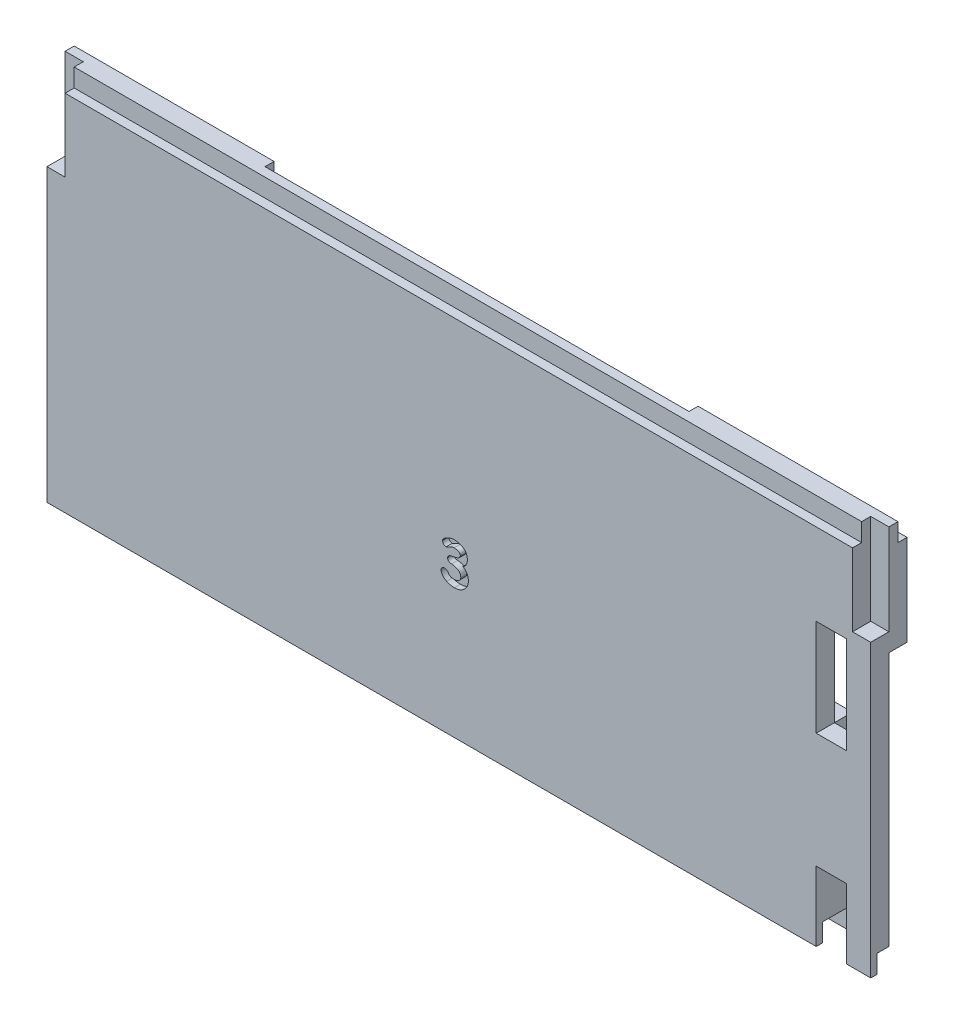
from build123d import *

# Parameters (mm, degrees)
SKETCH_1_W           = 130
SKETCH_1_H           = 60
EXTRUDE_1_DEPTH      = 6
EXTRUDE_2_DEPTH      = 3
EXTRUDE_2_DEPTH_BACK = 133
SKETCH_3_W           = 138.559648247
SKETCH_3_H           = 4
CUT_EXTRUDE_1_DEPTH  = 3
SKETCH_4_W           = 130
SKETCH_4_H           = 1.5
EXTRUDE_3_DEPTH      = 3
SKETCH_5_W           = 5
SKETCH_5_H           = 11.5
SKETCH_5_H_2         = 16
CUT_EXTRUDE_3_DEPTH  = 84.232914739
SKETCH_6_W           = 24
SKETCH_6_H           = 16
SKETCH_6_W_2         = 70
SKETCH_6_H_2         = 22.052103864
CUT_EXTRUDE_4_DEPTH  = 3
SKETCH_7_W           = 5
SKETCH_7_H           = 19
CUT_EXTRUDE_5_DEPTH  = 3
CUT_EXTRUDE_6_DEPTH  = 1


with BuildPart() as part:
    # 草圖1 → 填料-伸長1 (new body)
    with BuildSketch(Plane.XY):
        with Locations((7.338709677, 1.86827957)):
            Rectangle(SKETCH_1_W, SKETCH_1_H)
    extrude(amount=EXTRUDE_1_DEPTH)

    # 草圖2 → 填料-伸長2 (add, two sides: drawn at the far end of the back side and taken through both)
    with BuildSketch(Plane.ZY.offset(57.661290323).offset(-EXTRUDE_2_DEPTH_BACK)):
        Polygon((3, 16.86827957), (3, -28.13172043), (6, -28.13172043), (6, 19.86827957), (3, 19.86827957), align=None)
        Polygon((0, 16.86827957), (3, 16.86827957), (3, 19.86827957), (3, 31.86827957), (0, 31.86827957), align=None)
    extrude(amount=EXTRUDE_2_DEPTH + EXTRUDE_2_DEPTH_BACK)

    # 草圖3 → 除料-伸長1 (cut)
    with BuildSketch(Plane.XZ.offset(28.13172043)):
        with Locations((8.618533801, 3)):
            Rectangle(SKETCH_3_W, SKETCH_3_H)
    extrude(amount=-CUT_EXTRUDE_1_DEPTH, mode=Mode.SUBTRACT)

    # 草圖4 → 填料-伸長3 (add)
    with BuildSketch(Plane(origin=(0, 31.86827957, 0), x_dir=(1, 0, 0), z_dir=(0, 1, 0))):
        Polygon((-60.661290323, -3), (-57.661290323, -3), (72.338709677, -3), (75.338709677, -3), (75.338709677, -1.5), (-60.661290323, -1.5), align=None)
        with Locations((7.338709677, -3.75)):
            Rectangle(SKETCH_4_W, SKETCH_4_H)
    extrude(amount=EXTRUDE_3_DEPTH)

    # 草圖5 → 除料-伸長3 (cut, through all)
    with BuildSketch(Plane.XY.offset(6)):
        with Locations((68.838709677, -22.38172043)):
            Rectangle(SKETCH_5_W, SKETCH_5_H)
        with Locations((68.838709677, 10.36827957)):
            Rectangle(SKETCH_5_W, SKETCH_5_H_2)
    extrude(amount=-CUT_EXTRUDE_3_DEPTH, mode=Mode.SUBTRACT)

    # 草圖6 → 除料-伸長4 (cut)
    with BuildSketch(Plane(origin=(0, 0, 0), x_dir=(-1, 0, 0), z_dir=(0, 0, -1))):
        with Locations((-54.338709677, 10.36827957)):
            Rectangle(SKETCH_6_W, SKETCH_6_H)
        Polygon((27.661290323, 31.86827957), (-42.338709677, 31.86827957), (-42.338709677, 18.36827957), (-42.338709677, 2.36827957), (-42.338709677, -28.13172043), (27.661290323, -28.13172043), align=None)
        with Locations((-7.338709677, 42.894331502)):
            Rectangle(SKETCH_6_W_2, SKETCH_6_H_2)
    extrude(amount=-CUT_EXTRUDE_4_DEPTH, mode=Mode.SUBTRACT)

    # 草圖7 → 除料-伸長5 (cut)
    with BuildSketch(Plane(origin=(0, 0, 0), x_dir=(-1, 0, 0), z_dir=(0, 0, -1))):
        with Locations((-68.838709677, -7.13172043)):
            Rectangle(SKETCH_7_W, SKETCH_7_H)
    extrude(amount=-CUT_EXTRUDE_5_DEPTH, mode=Mode.SUBTRACT)

    # 草圖8 → 除料-伸長6 (cut)
    with BuildSketch(Plane.XY.offset(6)):
        with BuildLine():
            add(Edge.make_bspline(
                [(7.993418423, -2.970530339), (8.066595255, -3.013406491), (8.209521604, -3.097150642), (8.397381765, -3.253578026), (8.557581678, -3.427102139), (8.688705265, -3.620209151), (8.7897691, -3.832667722), (8.861606325, -4.063976346), (8.905399678, -4.313892399), (8.910437631, -4.486921314), (8.913029245, -4.575930481)],
                knots=[0, 0, 0, 0, 1.041256662, 2.033744932, 2.992333589, 3.936645621, 4.892015142, 5.874009964, 6.906352718, 8, 8, 8, 8], degree=3))
            add(Edge.make_bspline(
                [(8.913029245, -4.575930481), (8.911078345, -4.648761548), (8.907228033, -4.792501525), (8.87497864, -5.003549485), (8.822960176, -5.205981757), (8.748960612, -5.399447188), (8.654518955, -5.585062154), (8.537449928, -5.761295514), (8.400436171, -5.929609222), (8.244900224, -6.087682907), (8.074008598, -6.231142903), (7.892336287, -6.357850537), (7.701900039, -6.465313543), (7.501107997, -6.551899348), (7.292132833, -6.620109721), (7.073742385, -6.667786693), (6.847015683, -6.699539269), (6.692488686, -6.702389234), (6.61400219, -6.703836772)],
                knots=[0, 0, 0, 0, 1.002212465, 1.977974553, 2.931743396, 3.874694811, 4.82372372, 5.793001409, 6.781622883, 7.807418376, 8.841256573, 9.848957519, 10.852728399, 11.846063664, 12.854548786, 13.874037145, 14.920192732, 16, 16, 16, 16], degree=3))
            add(Edge.make_bspline(
                [(6.61400219, -6.703836772), (6.555183939, -6.703340941), (6.438669406, -6.702358738), (6.266544424, -6.686756349), (6.098546063, -6.665219681), (5.935016705, -6.633611185), (5.775632036, -6.59357328), (5.621264601, -6.542963144), (5.4701808, -6.486918755), (5.374004403, -6.439909879), (5.326024534, -6.41645839)],
                knots=[0, 0, 0, 0, 1.05965718, 2.099101179, 3.112385412, 4.111224021, 5.099027455, 6.071848788, 7.038096178, 8, 8, 8, 8], degree=3))
            add(Edge.make_bspline(
                [(5.326024534, -6.41645839), (5.272789139, -6.387772874), (5.168173069, -6.331401245), (5.023285822, -6.232500344), (4.890262528, -6.126680902), (4.770777774, -6.011631705), (4.665656406, -5.886578396), (4.573993307, -5.752632339), (4.494590043, -5.610412455), (4.454124975, -5.509526444), (4.433845285, -5.458965873)],
                knots=[0, 0, 0, 0, 1.082087955, 2.12647599, 3.135824101, 4.122733023, 5.090990016, 6.055441831, 7.025454846, 8, 8, 8, 8], degree=3))
            add(Edge.make_bspline(
                [(4.433845285, -5.458965873), (4.423720909, -5.426997543), (4.40325312, -5.362369262), (4.400146203, -5.294640379), (4.39857612, -5.260413536)],
                knots=[0, 0, 0, 0, 0.989298466, 2, 2, 2, 2], degree=3))
            add(Edge.make_bspline(
                [(4.39857612, -5.260413536), (4.401156424, -5.220495969), (4.406205639, -5.142384086), (4.444271574, -5.030505202), (4.50854286, -4.930131037), (4.567066877, -4.875629211), (4.597128456, -4.847633679)],
                knots=[0, 0, 0, 0, 1.010918152, 1.978194734, 2.96147491, 4, 4, 4, 4], degree=3))
            add(Edge.make_bspline(
                [(4.597128456, -4.847633679), (4.628631788, -4.824662771), (4.690759208, -4.779362062), (4.796022094, -4.732627608), (4.907158837, -4.702037779), (4.984011743, -4.698968883), (5.022970968, -4.697413161)],
                knots=[0, 0, 0, 0, 1.01419925, 2.000092675, 2.986182291, 4, 4, 4, 4], degree=3))
            add(Edge.make_bspline(
                [(5.022970968, -4.697413161), (5.067298856, -4.699635268), (5.153614276, -4.703962164), (5.275694429, -4.746339383), (5.383888945, -4.815952573), (5.440622221, -4.880069354), (5.469713725, -4.912946947)],
                knots=[0, 0, 0, 0, 1.031800181, 2.009124911, 2.979125573, 4, 4, 4, 4], degree=3))
            add(Edge.make_bspline(
                [(5.469713725, -4.912946947), (5.491768868, -4.942237856), (5.533419874, -4.997553563), (5.594160993, -5.073436156), (5.643851282, -5.141652962), (5.690895625, -5.195275804), (5.726801232, -5.241807115), (5.756305689, -5.276792497), (5.77900931, -5.300755508), (5.791471359, -5.313118664), (5.796280068, -5.317889212)],
                knots=[0, 0, 0, 0, 1.690402298, 3.192314723, 4.481219848, 5.578784001, 6.47860666, 7.190651391, 7.68769809, 8, 8, 8, 8], degree=3))
            add(Edge.make_bspline(
                [(5.796280068, -5.317889212), (5.820236173, -5.335550797), (5.868848054, -5.371389796), (5.951511578, -5.413474336), (6.040003267, -5.452191178), (6.137906331, -5.481792961), (6.24362106, -5.504973927), (6.357482522, -5.522217779), (6.47933261, -5.5305873), (6.563048209, -5.532459006), (6.606164598, -5.533422999)],
                knots=[0, 0, 0, 0, 0.835859375, 1.696131115, 2.601603443, 3.550757273, 4.567081016, 5.644524407, 6.78684972, 8, 8, 8, 8], degree=3))
            add(Edge.make_bspline(
                [(6.606164598, -5.533422999), (6.674325135, -5.530319195), (6.807790932, -5.524241607), (7.001663452, -5.479055801), (7.181300009, -5.401912975), (7.31813896, -5.314781929), (7.417330709, -5.234162166), (7.481069105, -5.168747549), (7.536072642, -5.10074154), (7.581647462, -5.030163903), (7.616099091, -4.955212958), (7.641205223, -4.878149051), (7.65572454, -4.797665224), (7.65791118, -4.743188223), (7.659014488, -4.715700876)],
                knots=[0, 0, 0, 0, 1.666219258, 3.262639795, 4.837171904, 6.426615232, 7.213376929, 7.958913229, 8.655780029, 9.350038053, 10.007548851, 10.667641844, 11.327734838, 12, 12, 12, 12], degree=3))
            add(Edge.make_bspline(
                [(7.659014488, -4.715700876), (7.657579155, -4.67298496), (7.654784749, -4.589822632), (7.63826629, -4.468232899), (7.607607125, -4.354677082), (7.567481437, -4.247104628), (7.513118583, -4.147439908), (7.447710954, -4.054615281), (7.37091585, -3.968323334), (7.281695687, -3.89013716), (7.180502944, -3.819175219), (7.066746695, -3.75717458), (6.943194745, -3.698632842), (6.805863204, -3.651805457), (6.658493606, -3.607875735), (6.498636363, -3.573166863), (6.327184841, -3.545851479), (6.208694666, -3.533408324), (6.147665453, -3.526999388)],
                knots=[0, 0, 0, 0, 0.955810387, 1.860838403, 2.737374971, 3.582163128, 4.423293324, 5.269147744, 6.117689912, 7.001019349, 7.917092324, 8.876420101, 9.896199517, 10.971411063, 12.118062531, 13.335157122, 14.627453601, 16, 16, 16, 16], degree=3))
            add(Edge.make_bspline(
                [(6.147665453, -3.526999388), (6.095630943, -3.520844966), (5.997504411, -3.509238975), (5.861769561, -3.473929075), (5.745443215, -3.426688485), (5.651292304, -3.362629248), (5.574485921, -3.287634114), (5.523706067, -3.195624566), (5.490353798, -3.092110109), (5.487093443, -3.018275435), (5.485388909, -2.979674197)],
                knots=[0, 0, 0, 0, 1.309733638, 2.469892026, 3.499967943, 4.433748782, 5.304370525, 6.158473042, 7.037237956, 8, 8, 8, 8], degree=3))
            add(Edge.make_bspline(
                [(5.485388909, -2.979674197), (5.486872174, -2.949917611), (5.489800003, -2.891180832), (5.513904826, -2.805975787), (5.555480929, -2.727763062), (5.612869982, -2.656322165), (5.685993207, -2.591857023), (5.775040573, -2.534774275), (5.8788742, -2.481715503), (5.955696975, -2.454508918), (5.99613867, -2.440186598)],
                knots=[0, 0, 0, 0, 0.893474987, 1.763637912, 2.635963712, 3.539448601, 4.503564701, 5.55268673, 6.711664664, 8, 8, 8, 8], degree=3))
            add(Edge.make_bspline(
                [(5.99613867, -2.440186598), (6.157294706, -2.40601909), (6.479370738, -2.337734118), (6.800847966, -2.266683442), (6.961468779, -2.231184139)],
                knots=[0, 0, 0, 0, 1.000732869, 2, 2, 2, 2], degree=3))
            add(Edge.make_bspline(
                [(6.961468779, -2.231184139), (7.009241117, -2.215938381), (7.100121582, -2.186935372), (7.224696694, -2.132275147), (7.331052831, -2.070945342), (7.418511416, -2.001900922), (7.486877073, -1.924332817), (7.537777443, -1.840799631), (7.567549693, -1.748444217), (7.572755689, -1.684932964), (7.575413504, -1.652508579)],
                knots=[0, 0, 0, 0, 1.326728886, 2.523923743, 3.593349401, 4.568973105, 5.459156461, 6.317041567, 7.140799652, 8, 8, 8, 8], degree=3))
            add(Edge.make_bspline(
                [(7.575413504, -1.652508579), (7.575708447, -1.626772798), (7.576281191, -1.576797055), (7.565042478, -1.504514311), (7.547543286, -1.436840494), (7.518816175, -1.375294775), (7.485437428, -1.316741104), (7.441516508, -1.263976196), (7.388875426, -1.217532158), (7.329339781, -1.174648797), (7.260388011, -1.138499918), (7.183929032, -1.106181447), (7.099221199, -1.078421495), (7.006525837, -1.056705085), (6.905307167, -1.039613822), (6.795749348, -1.028680341), (6.678137927, -1.020232875), (6.597037841, -1.019399557), (6.555220249, -1.018969874)],
                knots=[0, 0, 0, 0, 0.905003107, 1.757405462, 2.568519503, 3.3580313, 4.141862007, 4.9371622, 5.762506137, 6.609371556, 7.515154054, 8.497908821, 9.53095581, 10.650649656, 11.848298216, 13.143965626, 14.527344556, 16, 16, 16, 16], degree=3))
            add(Edge.make_bspline(
                [(6.555220249, -1.018969874), (6.496580407, -1.022185119), (6.374934104, -1.028855034), (6.190024958, -1.080027806), (5.997058496, -1.15879911), (5.837474129, -1.249561404), (5.710907434, -1.327365599), (5.620906578, -1.377869628), (5.539719936, -1.421502604), (5.466305161, -1.457349826), (5.400311492, -1.484603016), (5.342824772, -1.504400835), (5.293536022, -1.517779184), (5.26295311, -1.519697662), (5.248954877, -1.520575777)],
                knots=[0, 0, 0, 0, 1.490163767, 3.091292649, 4.849914727, 6.783197153, 7.751977744, 8.629874972, 9.407822437, 10.096426309, 10.707332206, 11.222231261, 11.644004201, 12, 12, 12, 12], degree=3))
            add(Edge.make_bspline(
                [(5.248954877, -1.520575777), (5.208643551, -1.518331129), (5.129569699, -1.513928075), (5.016368926, -1.478658781), (4.912801922, -1.420720805), (4.822345948, -1.341374051), (4.745548232, -1.249647452), (4.691386721, -1.147465881), (4.654412443, -1.040218484), (4.651065327, -0.965283205), (4.649379071, -0.927531298)],
                knots=[0, 0, 0, 0, 1.035722806, 2.031652168, 3.019798983, 4.068590413, 5.111560347, 6.079101792, 7.032263951, 8, 8, 8, 8], degree=3))
            add(Edge.make_bspline(
                [(4.649379071, -0.927531298), (4.651747706, -0.895865132), (4.656626509, -0.830640645), (4.694988829, -0.735229121), (4.7544288, -0.640905358), (4.836387708, -0.546709424), (4.943108539, -0.454300306), (5.070993715, -0.360646878), (5.222438312, -0.26776069), (5.333025047, -0.210527014), (5.391337802, -0.180347505)],
                knots=[0, 0, 0, 0, 0.689011849, 1.419194387, 2.212356324, 3.114598819, 4.130284888, 5.285019608, 6.568381767, 8, 8, 8, 8], degree=3))
            add(Edge.make_bspline(
                [(5.391337802, -0.180347505), (5.445078633, -0.153681313), (5.548969675, -0.102130594), (5.703898785, -0.036090324), (5.849914418, 0.021926921), (5.988237557, 0.069724281), (6.11946016, 0.104610721), (6.242219724, 0.131380346), (6.357515411, 0.148067435), (6.431947183, 0.150348291), (6.467700469, 0.151443899)],
                knots=[0, 0, 0, 0, 1.267894144, 2.451075708, 3.558629787, 4.588994206, 5.542361574, 6.426912053, 7.244367536, 8, 8, 8, 8], degree=3))
            add(Edge.make_bspline(
                [(6.467700469, 0.151443899), (6.54916029, 0.150210841), (6.708406436, 0.147800331), (6.941076807, 0.128414299), (7.161414511, 0.094338627), (7.369690555, 0.047493034), (7.566056313, -0.012115455), (7.749759937, -0.085947631), (7.922457583, -0.170831774), (8.027634969, -0.241010391), (8.079631938, -0.275704877)],
                knots=[0, 0, 0, 0, 1.154278458, 2.256503805, 3.305472961, 4.311400678, 5.279505846, 6.209908257, 7.115025121, 8, 8, 8, 8], degree=3))
            add(Edge.make_bspline(
                [(8.079631938, -0.275704877), (8.133071877, -0.315681381), (8.237868215, -0.394075766), (8.372644118, -0.533791921), (8.488781266, -0.683032079), (8.58465215, -0.845372499), (8.655594999, -1.022007626), (8.708214378, -1.209813084), (8.740239473, -1.410194774), (8.743932296, -1.54788806), (8.745827277, -1.618545679)],
                knots=[0, 0, 0, 0, 1.023681807, 2.00745186, 2.970680887, 3.923942752, 4.892752003, 5.885912951, 6.915151477, 8, 8, 8, 8], degree=3))
            add(Edge.make_bspline(
                [(8.745827277, -1.618545679), (8.743723516, -1.695758341), (8.739646817, -1.845382194), (8.703940387, -2.060887884), (8.645589979, -2.258839315), (8.56284722, -2.438709364), (8.455523558, -2.600223041), (8.324864869, -2.743836359), (8.170234691, -2.869894746), (8.053271781, -2.936464593), (7.993418423, -2.970530339)],
                knots=[0, 0, 0, 0, 1.132200477, 2.193995069, 3.194441578, 4.151949944, 5.087468466, 6.028142239, 6.990942448, 8, 8, 8, 8], degree=3))
        make_face()
    extrude(amount=-CUT_EXTRUDE_6_DEPTH, mode=Mode.SUBTRACT)


solid = part.part
